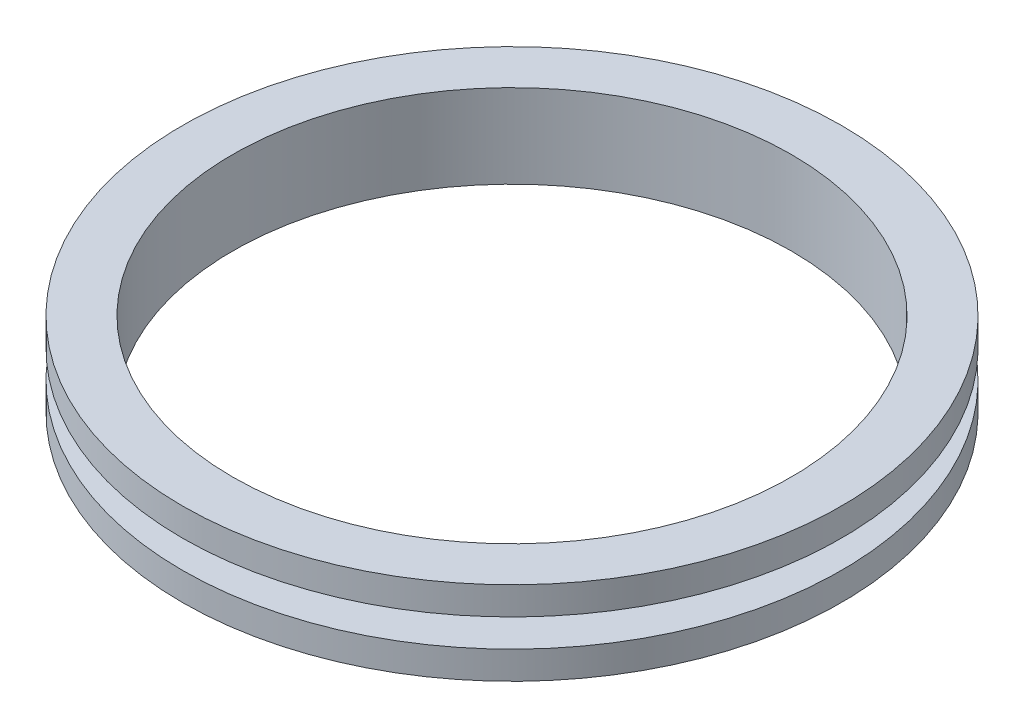
from build123d import *

# Parameters (mm, degrees)
SKETCH1_R           = 25.019
BOSS_EXTRUDE1_DEPTH = 2.116666667
SKETCH2_R           = 21.59
BOSS_EXTRUDE2_DEPTH = 2.116666667
SKETCH3_R           = 25.019
BOSS_EXTRUDE3_DEPTH = 2.116666667
SKETCH5_R           = 21.209
CUT_EXTRUDE1_DEPTH  = 36.947506478


with BuildPart() as part:
    # Sketch1 → Boss-Extrude1 (new body)
    with BuildSketch(Plane(origin=(0, 0, 0), x_dir=(1, 0, 0), z_dir=(0, 1, 0))):
        with Locations(Location((0, 0, 0), (0, 0, 270))):
            Circle(SKETCH1_R)
    extrude(amount=BOSS_EXTRUDE1_DEPTH)

    # Sketch2 → Boss-Extrude2 (add)
    with BuildSketch(Plane(origin=(0, 2.116666667, 0), x_dir=(1, 0, 0), z_dir=(0, 1, 0))):
        with Locations(Location((0, 0, 0), (0, 0, 270))):
            Circle(SKETCH2_R)
    extrude(amount=BOSS_EXTRUDE2_DEPTH)

    # Sketch3 → Boss-Extrude3 (add)
    with BuildSketch(Plane(origin=(0, 4.233333333, 0), x_dir=(1, 0, 0), z_dir=(0, 1, 0))):
        with Locations(Location((0, 0, 0), (0, 0, 270))):
            Circle(SKETCH3_R)
    extrude(amount=BOSS_EXTRUDE3_DEPTH)

    # Sketch5 → Cut-Extrude1 (cut, through all)
    with BuildSketch(Plane(origin=(0, 6.35, 0), x_dir=(1, 0, 0), z_dir=(0, 1, 0))):
        with Locations(Location((0, 0, 0), (0, 0, 270))):
            Circle(SKETCH5_R)
    extrude(amount=-CUT_EXTRUDE1_DEPTH, mode=Mode.SUBTRACT)


solid = part.part
